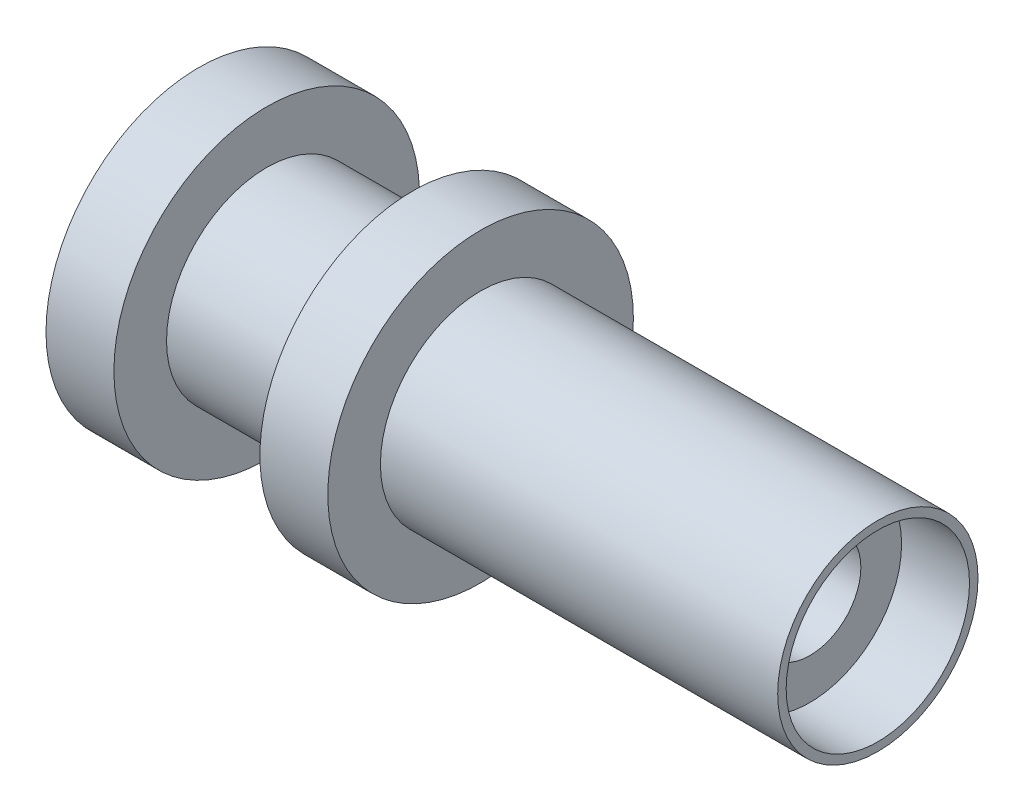
from build123d import *

# Parameters (mm, degrees)
SKETCH1_R               = 2.95
BOSS_EXTRUDE1_DEPTH     = 18
SKETCH2_R               = 2.7
CUT_EXTRUDE1_DEPTH      = 2
CUT_EXTRUDE2_DEPTH      = 17.534962957
CUT_EXTRUDE2_DEPTH_BACK = 17.534962957
SKETCH3_R               = 1.5
SKETCH4_R               = 4.5
BOSS_EXTRUDE2_DEPTH     = 2
BOSS_EXTRUDE3_START     = -6.3
SKETCH4_3_R             = 4.5
BOSS_EXTRUDE3_DEPTH     = 2
CUT_EXTRUDE3_DEPTH      = 21.988091862
CUT_EXTRUDE3_DEPTH_BACK = 21.988091862
SKETCH5_R               = 1.5
CUT_EXTRUDE4_DEPTH      = 21.988091862
CUT_EXTRUDE4_DEPTH_BACK = 1


with BuildPart() as part:
    # Sketch1 → Boss-Extrude1 (new body)
    with BuildSketch(Plane(origin=(0, 0, 0), x_dir=(0, 0, -1), z_dir=(1, 0, 0))):
        Circle(SKETCH1_R)
    extrude(amount=BOSS_EXTRUDE1_DEPTH)

    # Sketch2 → Cut-Extrude1 (cut)
    with BuildSketch(Plane(origin=(18, 0, 0), x_dir=(0, 0, -1), z_dir=(1, 0, 0))):
        Circle(SKETCH2_R)
    extrude(amount=-CUT_EXTRUDE1_DEPTH, mode=Mode.SUBTRACT)

    # Sketch3 → Cut-Extrude2 (cut, two sides: drawn at the far end of the back side and taken through both)
    with BuildSketch(Plane(origin=(16, 0, 0), x_dir=(0, 0, -1), z_dir=(1, 0, 0)).offset(-CUT_EXTRUDE2_DEPTH_BACK)):
        Circle(SKETCH3_R)
    extrude(amount=CUT_EXTRUDE2_DEPTH + CUT_EXTRUDE2_DEPTH_BACK, mode=Mode.SUBTRACT)

    # Sketch4 → Boss-Extrude2 (add)
    with BuildSketch(Plane.ZY):
        Circle(SKETCH4_R)
    extrude(amount=BOSS_EXTRUDE2_DEPTH)

    # Sketch4<3> → Boss-Extrude3 (add)
    with BuildSketch(Plane.ZY.offset(BOSS_EXTRUDE3_START)):
        Circle(SKETCH4_3_R)
    extrude(amount=BOSS_EXTRUDE3_DEPTH)

    # Sketch5 → Cut-Extrude3 (cut, two sides: drawn at the far end of the back side and taken through both)
    with BuildSketch(Plane.ZY.offset(2).offset(-CUT_EXTRUDE3_DEPTH_BACK)):
        with Locations(Location((0, 0, 0), (0, 0, 180))):
            Circle(SKETCH5_R)
    extrude(amount=CUT_EXTRUDE3_DEPTH + CUT_EXTRUDE3_DEPTH_BACK, mode=Mode.SUBTRACT)

    # Sketch6 → Cut-Extrude4 (cut, two sides: drawn at the far end of the back side and taken through both)
    with BuildSketch(Plane.ZY.offset(2).offset(-CUT_EXTRUDE4_DEPTH_BACK)):
        Polygon((2.75, -1.58771324), (2.75, 1.58771324), (0, 3.175426481), (-2.75, 1.58771324), (-2.75, -1.58771324), (0, -3.175426481), align=None)
    extrude(amount=CUT_EXTRUDE4_DEPTH + CUT_EXTRUDE4_DEPTH_BACK, mode=Mode.SUBTRACT)


solid = part.part
